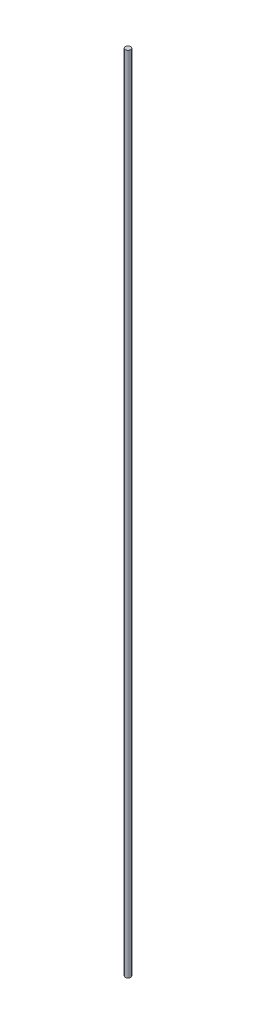
from build123d import *

# Parameters (mm, degrees)
SKETCH1_R           = 3
BOSS_EXTRUDE1_DEPTH = 900


with BuildPart() as part:
    # Sketch1 → Boss-Extrude1 (new body)
    with BuildSketch(Plane(origin=(0, 0, 0), x_dir=(1, 0, 0), z_dir=(0, 1, 0))):
        with Locations(Location((0, 0, 0), (0, 0, 270))):
            Circle(SKETCH1_R)
    extrude(amount=BOSS_EXTRUDE1_DEPTH)


solid = part.part
